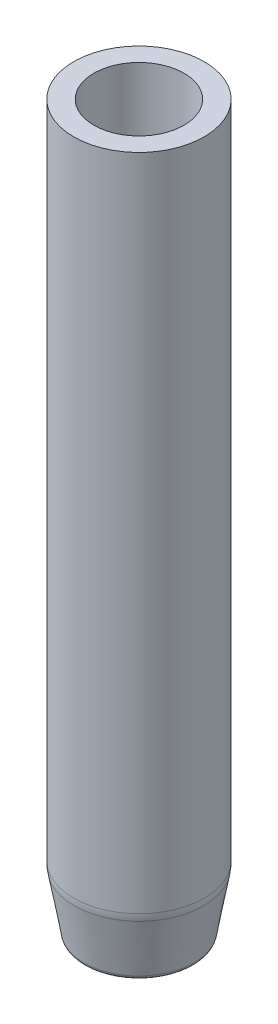
from build123d import *


with BuildPart() as part:
    # Sketch1 → Revolve1 (revolve)
    with BuildSketch(Plane.XY, mode=Mode.PRIVATE) as revolve1_sk:
        with BuildLine():
            Line((-3.556, 28.575), (-5.1435, 28.575))
            Line((-5.1435, 28.575), (-5.1435, -23.435000842))
            ThreePointArc((-5.1435, -23.435000842), (-5.131418166, -23.711720325), (-5.095264616, -23.986333806))
            Line((-5.095264616, -23.986333806), (-4.343720577, -28.24855185))
            ThreePointArc((-4.343720577, -28.24855185), (-3.918285065, -28.575), (-3.556, -28.179635229))
            Line((-3.556, -28.179635229), (-3.556, 28.575))
        make_face()
    revolve(revolve1_sk.sketch.rotate(Axis((0, 28.575, 0), (0, -1, 0)), 270), axis=Axis((0, 28.575, 0), (0, -1, 0)))


solid = part.part
